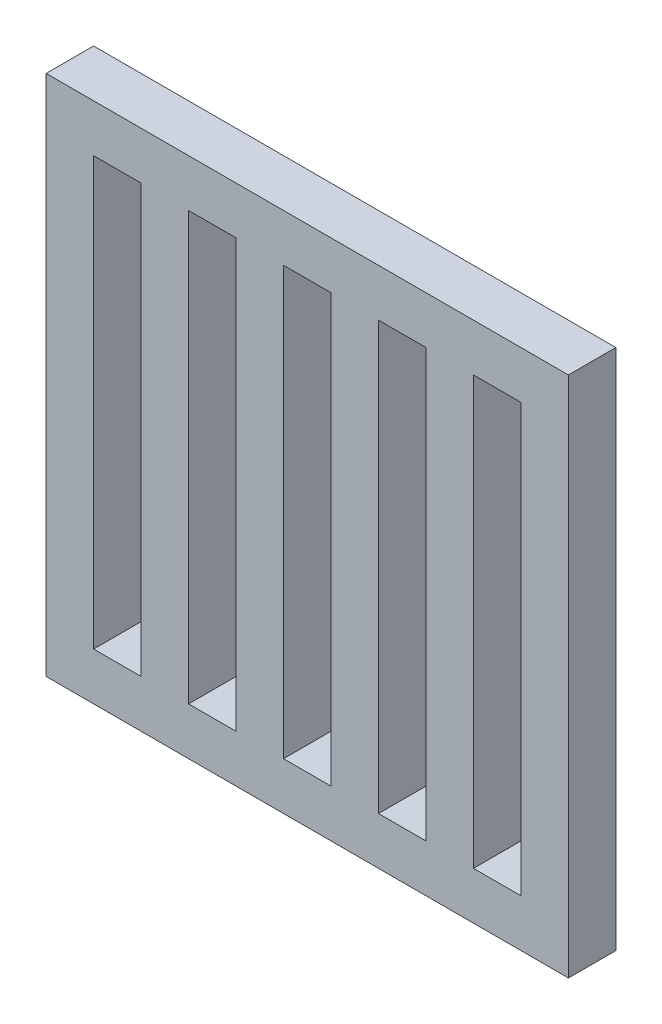
from build123d import *

# Parameters (mm, degrees)
SKETCH_1_W          = 550
SKETCH_1_H          = 550
EXTRUDE_1_DEPTH     = 50
SKETCH_4_W          = 50
SKETCH_4_H          = 450
CUT_EXTRUDE_2_DEPTH = 780.422863406


with BuildPart() as part:
    # Эскиз1 → Бобышка-Вытянуть1 (new body)
    with BuildSketch(Plane.XY):
        with Locations((275, -275)):
            Rectangle(SKETCH_1_W, SKETCH_1_H)
    extrude(amount=EXTRUDE_1_DEPTH)

    # Эскиз4 → Вырез-Вытянуть2 (cut, through all)
    with BuildSketch(Plane.XY.offset(50)):
        with Locations((75, -275)):
            Rectangle(SKETCH_4_W, SKETCH_4_H)
        with Locations((175, -275)):
            Rectangle(SKETCH_4_W, SKETCH_4_H)
        with Locations((275, -275)):
            Rectangle(SKETCH_4_W, SKETCH_4_H)
        with Locations((375, -275)):
            Rectangle(SKETCH_4_W, SKETCH_4_H)
        with Locations((475, -275)):
            Rectangle(SKETCH_4_W, SKETCH_4_H)
    extrude(amount=-CUT_EXTRUDE_2_DEPTH, mode=Mode.SUBTRACT)


solid = part.part
